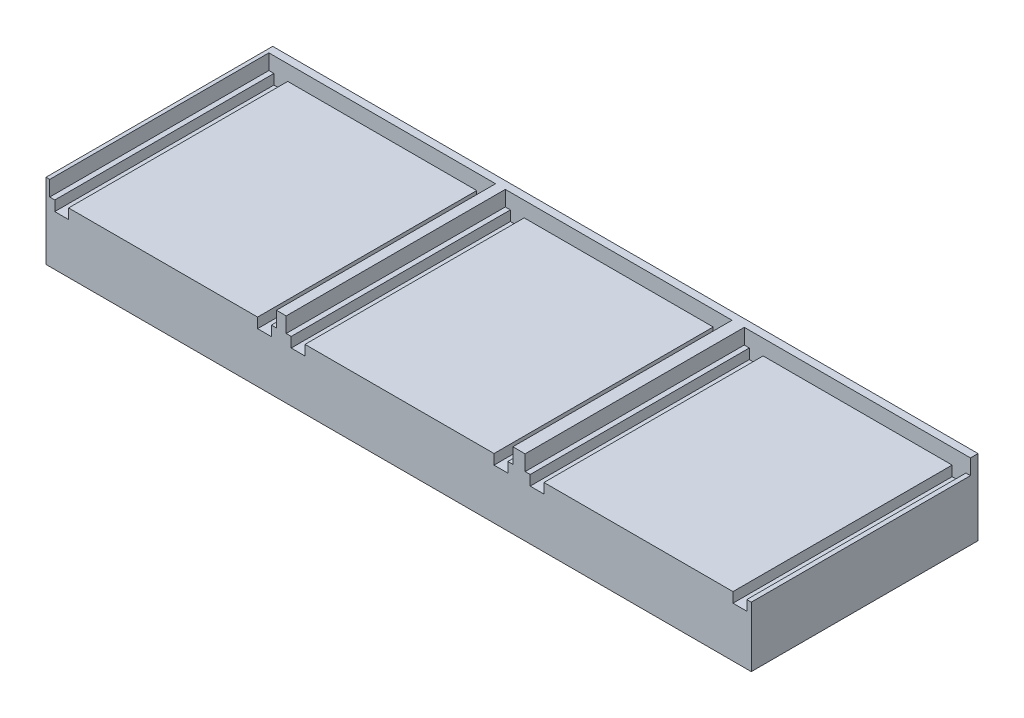
from build123d import *

# Parameters (mm, degrees)
BOSS_EXTRUDE1_DEPTH = 30
CUT_EXTRUDE1_DEPTH  = 87


with BuildPart() as part:
    # Sketch1 → Boss-Extrude1 (new body)
    with BuildSketch(Plane(origin=(0, 0, 0), x_dir=(1, 0, 0), z_dir=(0, 1, 0))):
        Polygon((250, -90), (110, -90), (110, 0), (390, 0), (390, -90), align=None)
    extrude(amount=BOSS_EXTRUDE1_DEPTH)

    # Sketch3 → Cut-Extrude1 (cut)
    with BuildSketch(Plane.XY.offset(90)):
        Polygon((113.483053539, 23.920467505), (111.483053539, 23.920467505), (111.483053539, 30.115083869), (201.483053539, 30.115083869), (201.483053539, 23.920467505), (199.483053539, 23.920467505), (199.483053539, 19.920467505), (193.9996064, 19.920467505), (193.9996064, 23.920467505), (118.966500679, 23.920467505), (118.966500679, 19.920467505), (113.483053539, 19.920467505), align=None)
        Polygon((302.21010009, 23.900544193), (300.21010009, 23.900544193), (300.21010009, 30.459376692), (390.21010009, 30.459376692), (390.21010009, 23.900544193), (388.21010009, 23.900544193), (388.21010009, 19.900544193), (382.72665295, 19.900544193), (382.72665295, 23.900544193), (307.69354723, 23.900544193), (307.69354723, 19.900544193), (302.21010009, 19.900544193), align=None)
        Polygon((207.348367676, 23.942050812), (205.348367676, 23.942050812), (205.348367676, 30.00297672), (295.348367676, 30.00297672), (295.348367676, 23.942050812), (293.348367676, 23.942050812), (293.348367676, 19.942050812), (287.864920536, 19.942050812), (287.864920536, 23.942050812), (212.831814816, 23.942050812), (212.831814816, 19.942050812), (207.348367676, 19.942050812), align=None)
    extrude(amount=-CUT_EXTRUDE1_DEPTH, mode=Mode.SUBTRACT)


solid = part.part
